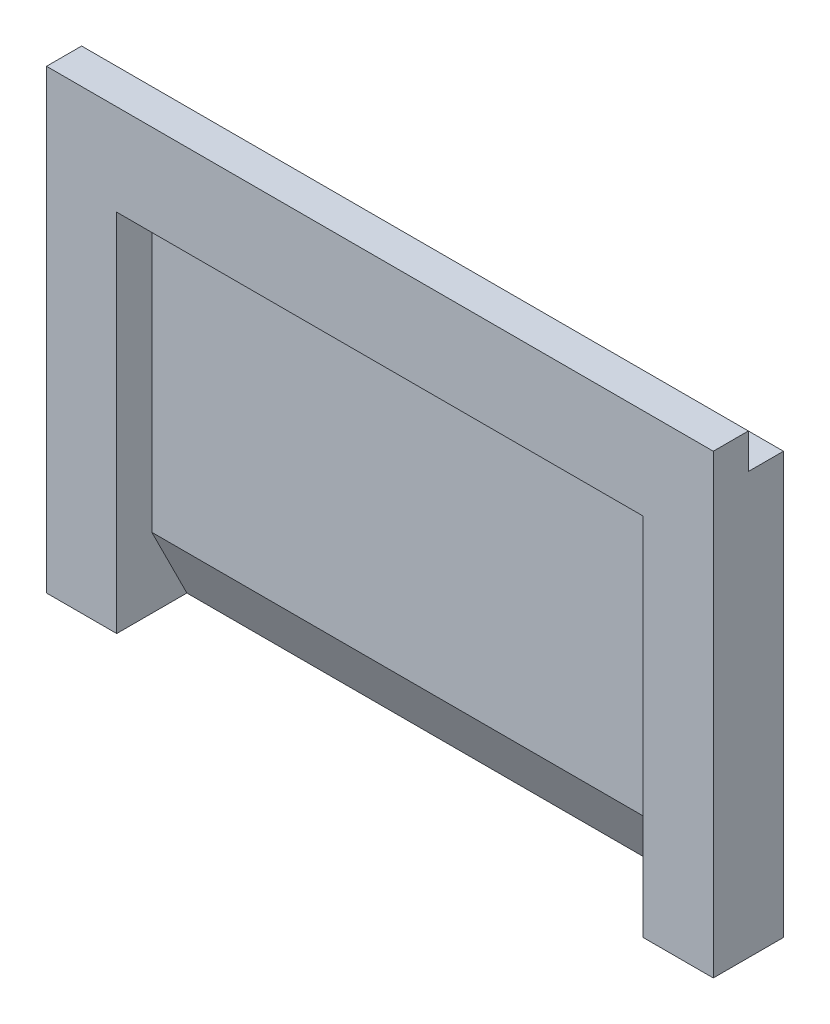
from build123d import *

# Parameters (mm, degrees)
SKETCH1_W           = 95
SKETCH1_H           = 60
BOSS_EXTRUDE1_DEPTH = 10
CUT_EXTRUDE1_DEPTH  = 5
CUT_EXTRUDE2_DEPTH  = 75
SKETCH7_W           = 95
SKETCH7_H           = 5
BOSS_EXTRUDE3_DEPTH = 5


with BuildPart() as part:
    # Sketch1 → Boss-Extrude1 (new body)
    with BuildSketch(Plane.XY):
        with Locations((47.5, 30)):
            Rectangle(SKETCH1_W, SKETCH1_H)
    extrude(amount=BOSS_EXTRUDE1_DEPTH)

    # Sketch2 → Cut-Extrude1 (cut)
    with BuildSketch(Plane.XY.offset(10)):
        Polygon((10, 50), (10, 52), (85, 52), (85, 50), (85, 10), (10, 10), align=None)
    extrude(amount=-CUT_EXTRUDE1_DEPTH, mode=Mode.SUBTRACT)

    # Sketch4 → Cut-Extrude2 (cut)
    with BuildSketch(Plane(origin=(10, 0, 0), x_dir=(0, 0, -1), z_dir=(1, 0, 0))):
        Polygon((0, 0), (-5, 10), (-10, 10), (-10, 0), align=None)
    extrude(amount=CUT_EXTRUDE2_DEPTH, mode=Mode.SUBTRACT)

    # Sketch7 → Boss-Extrude3 (add)
    with BuildSketch(Plane(origin=(0, 60, 0), x_dir=(1, 0, 0), z_dir=(0, 1, 0))):
        with Locations((47.5, -7.5)):
            Rectangle(SKETCH7_W, SKETCH7_H)
    extrude(amount=BOSS_EXTRUDE3_DEPTH)


solid = part.part
